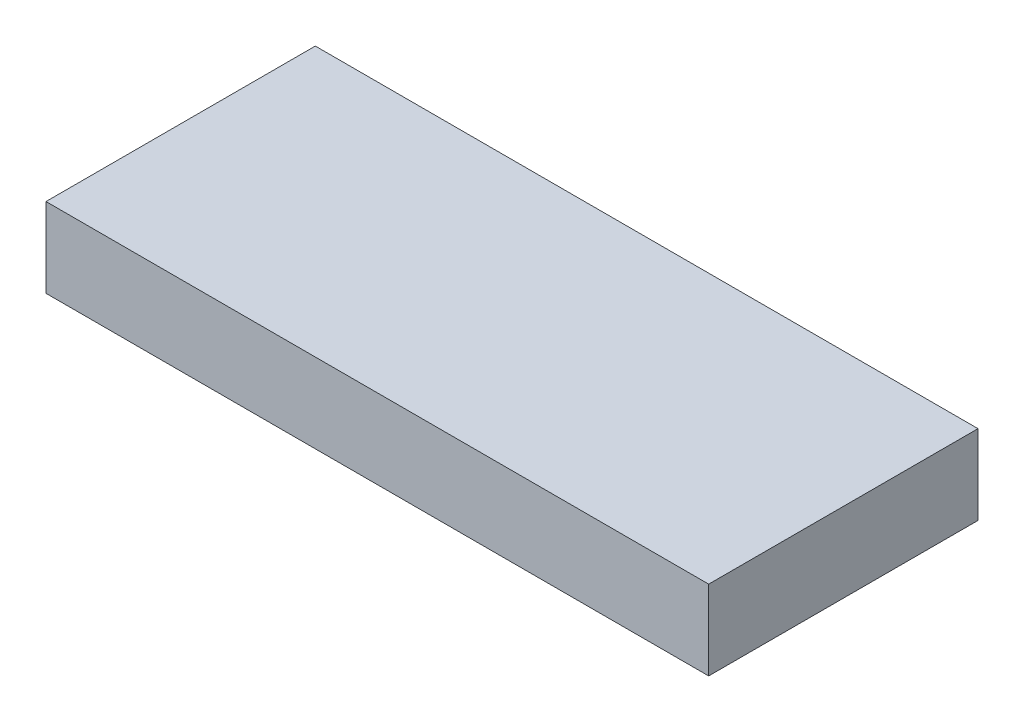
from build123d import *

# Parameters (mm, degrees)
SKETCH2_W           = 62.5
SKETCH2_H           = 25.4
BOSS_EXTRUDE1_DEPTH = 7.5


with BuildPart() as part:
    # Sketch2 → Boss-Extrude1 (new body)
    with BuildSketch(Plane(origin=(0, 0, 0), x_dir=(1, 0, 0), z_dir=(0, 1, 0))):
        Rectangle(SKETCH2_W, SKETCH2_H)
    extrude(amount=BOSS_EXTRUDE1_DEPTH)


solid = part.part
